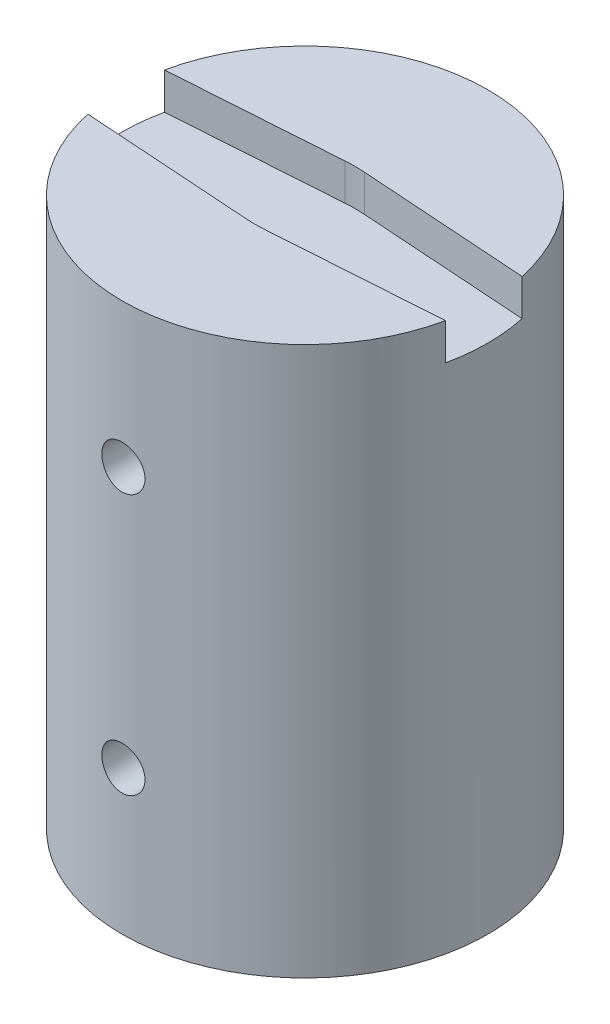
from build123d import *

# Parameters (mm, degrees)
SKETCH1_R               = 12.7
SKETCH1_R_2             = 10.16
BOSS_EXTRUDE1_DEPTH     = 38.1
BOSS_EXTRUDE2_START     = -5.08
SKETCH2_R               = 12.7
BOSS_EXTRUDE2_DEPTH     = 5.08
CUT_EXTRUDE1_START      = -2.54
CUT_EXTRUDE1_DEPTH      = 2.54
FILLET1_R               = 10
CUT_EXTRUDE2_DEPTH      = 48.519048812
CUT_EXTRUDE2_DEPTH_BACK = 48.519048812
SKETCH5_R               = 1.5


with BuildPart() as part:
    # Sketch1 → Boss-Extrude1 (new body)
    with BuildSketch(Plane(origin=(0, 0, 0), x_dir=(1, 0, 0), z_dir=(0, 1, 0))):
        with Locations(Location((0, 0, 0), (0, 0, 90))):
            Circle(SKETCH1_R)
        with Locations(Location((0, 0, 0), (0, 0, 90))):
            Circle(SKETCH1_R_2, mode=Mode.SUBTRACT)
    extrude(amount=BOSS_EXTRUDE1_DEPTH)

    # Sketch2 → Boss-Extrude2 (add)
    with BuildSketch(Plane(origin=(0, 38.1, 0), x_dir=(1, 0, 0), z_dir=(0, 1, 0)).offset(BOSS_EXTRUDE2_START)):
        with Locations(Location((0, 0, 0), (0, 0, 90))):
            Circle(SKETCH2_R)
    extrude(amount=BOSS_EXTRUDE2_DEPTH)

    # Sketch3 → Cut-Extrude1 (cut)
    with BuildSketch(Plane(origin=(0, 38.1, 0), x_dir=(1, 0, 0), z_dir=(0, 1, 0)).offset(CUT_EXTRUDE1_START)):
        with BuildLine():
            Line((0, 3.5), (-12.418726065, 2.65805247))
            ThreePointArc((-12.418726065, 2.65805247), (-12.7, 0), (-12.418726065, -2.65805247))
            Line((-12.418726065, -2.65805247), (0, -3.5))
            Line((0, -3.5), (12.418726065, -2.65805247))
            ThreePointArc((12.418726065, -2.65805247), (12.7, 0), (12.418726065, 2.65805247))
            Line((12.418726065, 2.65805247), (0, 3.5))
        make_face()
    extrude(amount=CUT_EXTRUDE1_DEPTH, mode=Mode.SUBTRACT)

    # Fillet1
    fillet1_edges = [part.edges().sort_by_distance(p)[0] for p in [
        (0, 36.83, 3.5),
        (0, 36.83, -3.5),
    ]]
    fillet(fillet1_edges, radius=FILLET1_R)

    # Sketch5 → Cut-Extrude2 (cut, two sides: drawn at the far end of the back side and taken through both)
    with BuildSketch(Plane.XY.offset(-12.7).offset(-CUT_EXTRUDE2_DEPTH_BACK)):
        with Locations(Location((0, 28.1, 0), (0, 0, 270.000000018))):
            Circle(SKETCH5_R)
        with Locations(Location((0, 10, 0), (0, 0, 270.000000018))):
            Circle(SKETCH5_R)
    extrude(amount=CUT_EXTRUDE2_DEPTH + CUT_EXTRUDE2_DEPTH_BACK, mode=Mode.SUBTRACT)


solid = part.part
